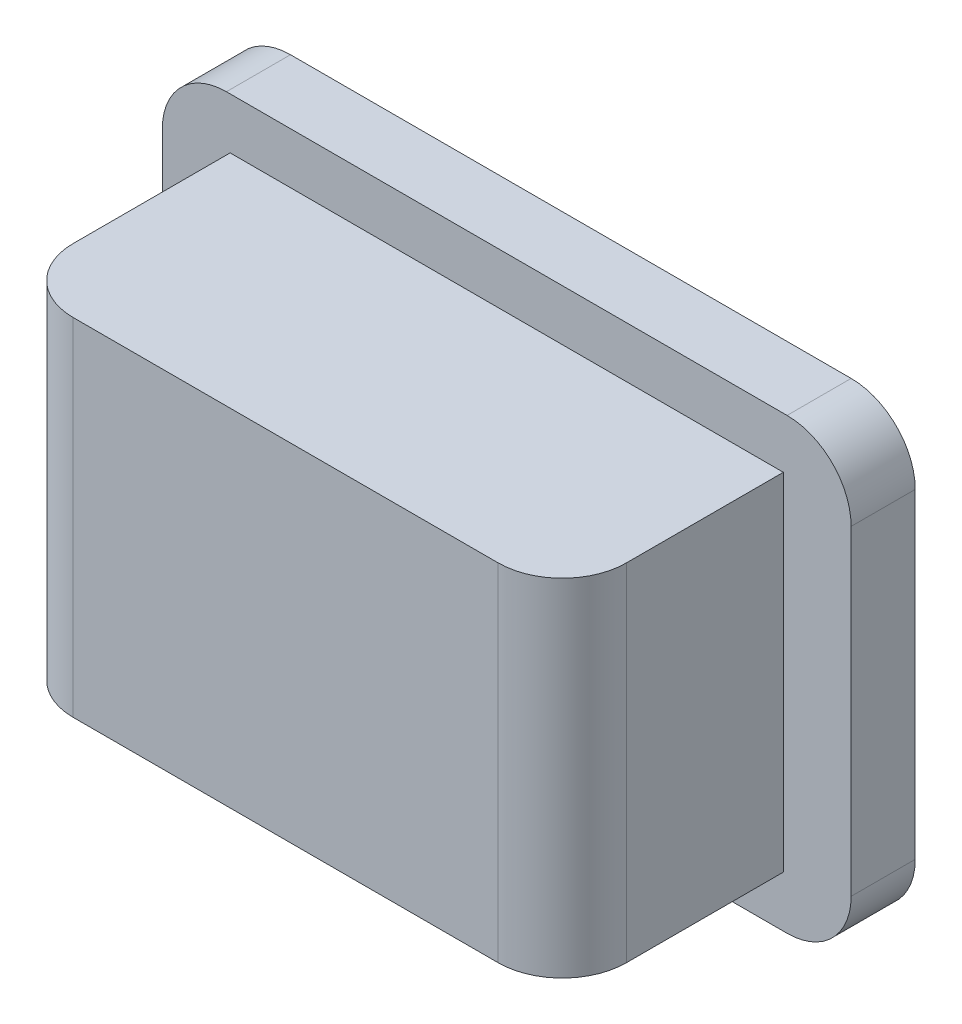
from build123d import *

# Parameters (mm, degrees)
BOSS_EXTRUDE1_DEPTH = 2
SKETCH2_W           = 17.267499136
SKETCH2_H           = 10.808758156
BOSS_EXTRUDE2_DEPTH = 6.9
FILLET3_R           = 2


with BuildPart() as part:
    # Sketch1 → Boss-Extrude1 (new body)
    with BuildSketch(Plane.XY):
        with BuildLine():
            Line((-8.75, -7), (8.75, -7))
            ThreePointArc((8.75, -7), (10.164213562, -6.414213562), (10.75, -5))
            Line((10.75, -5), (10.75, 5))
            ThreePointArc((10.75, 5), (10.164213562, 6.414213562), (8.75, 7))
            Line((8.75, 7), (-8.75, 7))
            ThreePointArc((-8.75, 7), (-10.164213562, 6.414213562), (-10.75, 5))
            Line((-10.75, 5), (-10.75, -5))
            ThreePointArc((-10.75, -5), (-10.164213562, -6.414213562), (-8.75, -7))
        make_face()
    extrude(amount=BOSS_EXTRUDE1_DEPTH)

    # Sketch2 → Boss-Extrude2 (add)
    with BuildSketch(Plane.XY.offset(2)):
        Rectangle(SKETCH2_W, SKETCH2_H)
    extrude(amount=BOSS_EXTRUDE2_DEPTH)

    # Fillet3
    fillet3_edges = [part.edges().sort_by_distance(p)[0] for p in [
        (8.633749568, 0, 8.9),
        (-8.633749568, 0, 8.9),
    ]]
    fillet(fillet3_edges, radius=FILLET3_R)


solid = part.part
